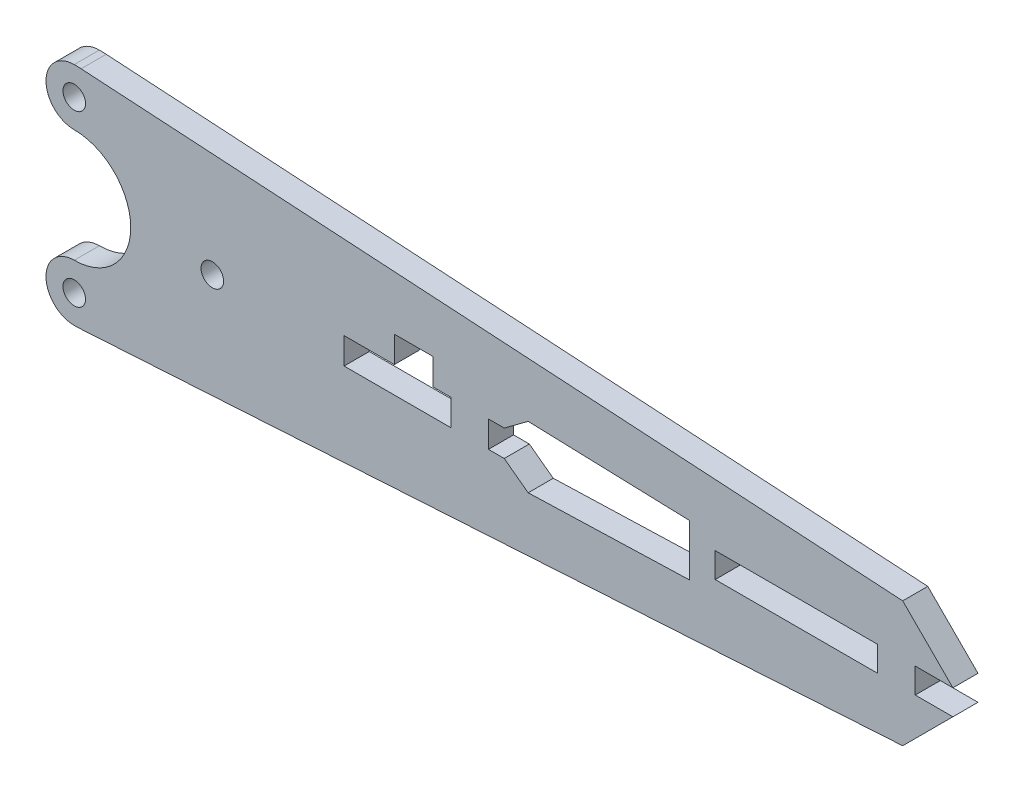
from build123d import *

# Parameters (mm, degrees)
SKETCH_1_R      = 0.9
SKETCH_1_W      = 12.938114719
SKETCH_1_H      = 2
EXTRUDE_1_DEPTH = 2


with BuildPart() as part:
    # 草图1 → 凸台-拉伸1 (new body)
    with BuildSketch(Plane.XY):
        with BuildLine():
            Line((42, 1), (45, 1))
            Line((45, 1), (41, 5))
            Line((41, 5), (-24.453286313, 8.983379328))
            ThreePointArc((-24.453286313, 8.983379328), (-24.726516864, 8.995843872), (-25, 9))
            ThreePointArc((-25, 9), (-27.25, 6.75), (-25, 4.5))
            ThreePointArc((-25, 4.5), (-20.5, 0), (-25, -4.5))
            ThreePointArc((-25, -4.5), (-27.25, -6.75), (-25, -9))
            ThreePointArc((-25, -9), (-24.726516864, -8.995843872), (-24.453286313, -8.983379328))
            Line((-24.453286313, -8.983379328), (41, -5))
            Line((41, -5), (45, -1))
            Line((45, -1), (42, -1))
            Line((42, -1), (42, 1))
        make_face()
        with Locations((-25, 6.75)):
            Circle(SKETCH_1_R, mode=Mode.SUBTRACT)
        with Locations((-25, -6.75)):
            Circle(SKETCH_1_R, mode=Mode.SUBTRACT)
        with Locations((-14, 0)):
            Circle(SKETCH_1_R, mode=Mode.SUBTRACT)
        Polygon((5, 1.05), (3.6, 1.05), (3.6, 3.15), (0.5, 3.15), (0.5, 1.05), (-3.5, 1.05), (-3.5, -1.05), (5, -1.05), align=None, mode=Mode.SUBTRACT)
        with Locations((32.530942641, 0)):
            Rectangle(SKETCH_1_W, SKETCH_1_H, mode=Mode.SUBTRACT)
        Polygon((24.030895161, -2.05), (11.162143386, -2.463125002), (9.25663283, -1.05), (7.998759736, -1.05), (7.998759736, 1.05), (9.25663283, 1.05), (11.162143386, 2.463125002), (24.030895161, 2.05), align=None, mode=Mode.SUBTRACT)
    extrude(amount=EXTRUDE_1_DEPTH)


solid = part.part
